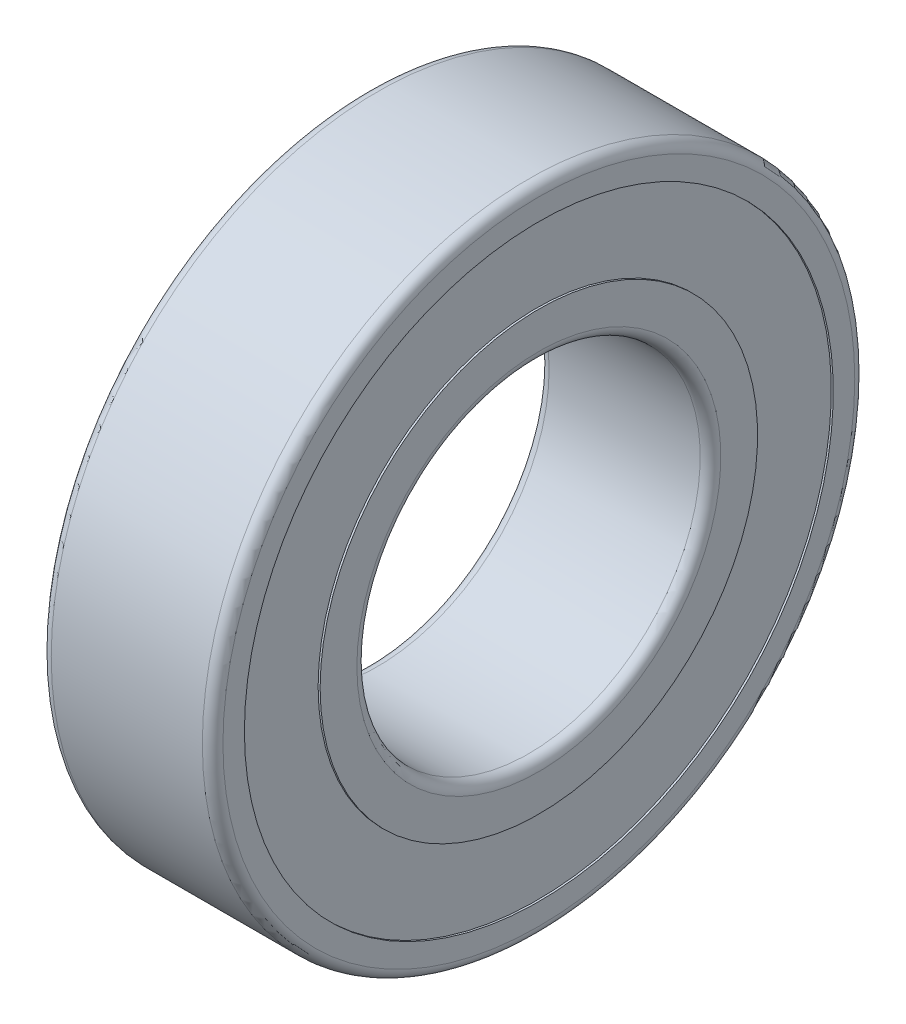
from build123d import *

# Parameters (mm, degrees)
FILLET1_R = 0.3
FILLET2_R = 0.3


with BuildPart() as part:
    # Sketch1 → Revolve1 (revolve)
    with BuildSketch(Plane.XY, mode=Mode.PRIVATE) as revolve1_sk:
        Polygon((0, 5), (5, 5), (5, 6.37), (4.942, 6.37), (4.942, 8.575), (5, 8.575), (5, 9.5), (0, 9.5), (0, 8.575), (0.058, 8.575), (0.058, 6.37), (0, 6.37), align=None)
    revolve(revolve1_sk.sketch.rotate(Axis((0, 0, 0), (1, 0, 0)), 90), axis=Axis((0, 0, 0), (1, 0, 0)))

    # Fillet1
    fillet1_edges = [part.edges().sort_by_distance(p)[0] for p in [
        (0, 0, -9.5),
        (5, 0, -9.5),
    ]]
    fillet(fillet1_edges, radius=FILLET1_R)

    # Fillet2
    fillet2_edges = [part.edges().sort_by_distance(p)[0] for p in [
        (5, 0, -5),
        (0, 0, -5),
    ]]
    fillet(fillet2_edges, radius=FILLET2_R)


solid = part.part
